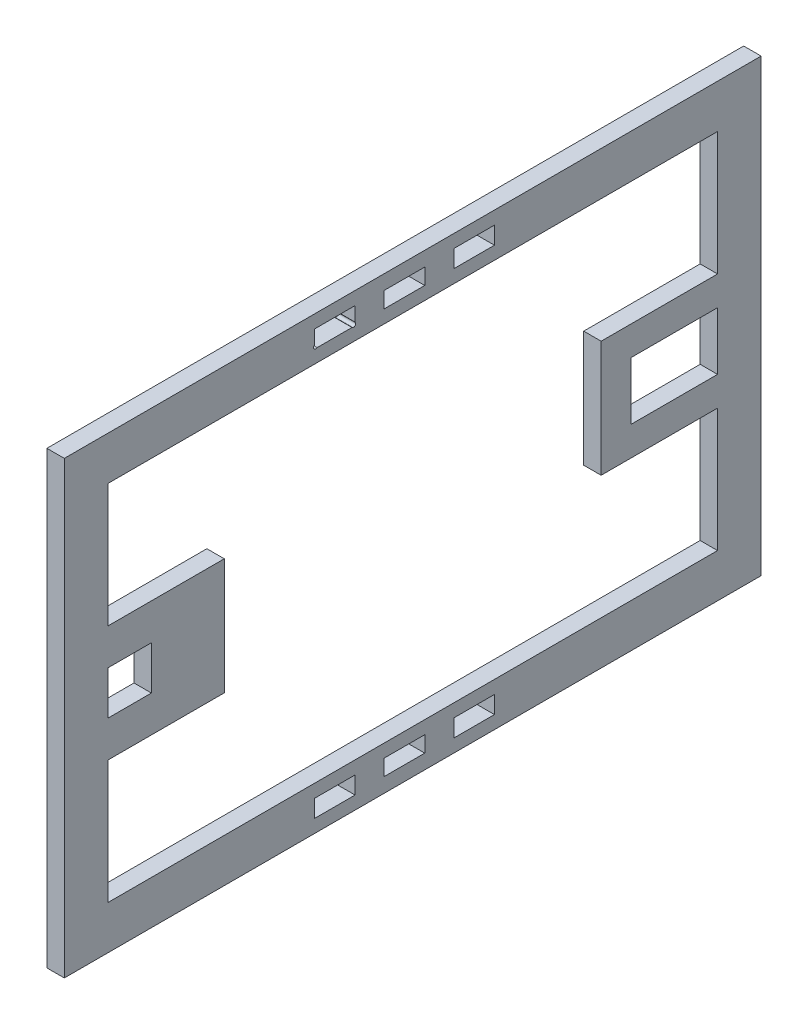
from build123d import *

# Parameters (mm, degrees)
CROQUIS1_W              = 480
CROQUIS1_H              = 310
CROQUIS1_W_2            = 28
CROQUIS1_H_2            = 12
CROQUIS1_H_3            = 11
CROQUIS1_W_3            = 30
CROQUIS1_H_4            = 30
CROQUIS1_W_4            = 59.55
CROQUIS1_H_5            = 39.8
SALIENTE_EXTRUIR1_DEPTH = 12
CROQUIS6_R              = 1.5
CORTAR_EXTRUIR2_DEPTH   = 12


with BuildPart() as part:
    # Croquis1 → Saliente-Extruir1 (new body)
    with BuildSketch(Plane(origin=(0, 0, 0), x_dir=(0, 0, -1), z_dir=(1, 0, 0))):
        with Locations((240, -155)):
            Rectangle(CROQUIS1_W, CROQUIS1_H)
        Polygon((30, -30), (450, -30), (450, -115), (369.8, -115), (369.8, -195), (450, -195), (450, -280), (30, -280), (30, -195), (110.2, -195), (110.2, -115), (30, -115), align=None, mode=Mode.SUBTRACT)
        with Locations((282.300325034, -295)):
            Rectangle(CROQUIS1_W_2, CROQUIS1_H_2, mode=Mode.SUBTRACT)
        with Locations((234.300325034, -294.5)):
            Rectangle(CROQUIS1_W_2, CROQUIS1_H_3, mode=Mode.SUBTRACT)
        with Locations((186.300325034, -295)):
            Rectangle(CROQUIS1_W_2, CROQUIS1_H_2, mode=Mode.SUBTRACT)
        with Locations((186.300325034, -15)):
            Rectangle(CROQUIS1_W_2, CROQUIS1_H_2, mode=Mode.SUBTRACT)
        with Locations((282.300325034, -15)):
            Rectangle(CROQUIS1_W_2, CROQUIS1_H_2, mode=Mode.SUBTRACT)
        with Locations((234.300325034, -15.5)):
            Rectangle(CROQUIS1_W_2, CROQUIS1_H_3, mode=Mode.SUBTRACT)
        with Locations((45, -155)):
            Rectangle(CROQUIS1_W_3, CROQUIS1_H_4, mode=Mode.SUBTRACT)
        with Locations((420.225, -155)):
            Rectangle(CROQUIS1_W_4, CROQUIS1_H_5, mode=Mode.SUBTRACT)
    extrude(amount=SALIENTE_EXTRUIR1_DEPTH)

    # Croquis6 → Cortar-Extruir2 (cut)
    with BuildSketch(Plane(origin=(12, 0, 0), x_dir=(0, 0, -1), z_dir=(1, 0, 0))):
        with Locations((173.24106245, -19.831662243)):
            Circle(CROQUIS6_R)
        with Locations((199.239664862, -19.939339828)):
            Circle(CROQUIS6_R)
    extrude(amount=-CORTAR_EXTRUIR2_DEPTH, mode=Mode.SUBTRACT)


solid = part.part
